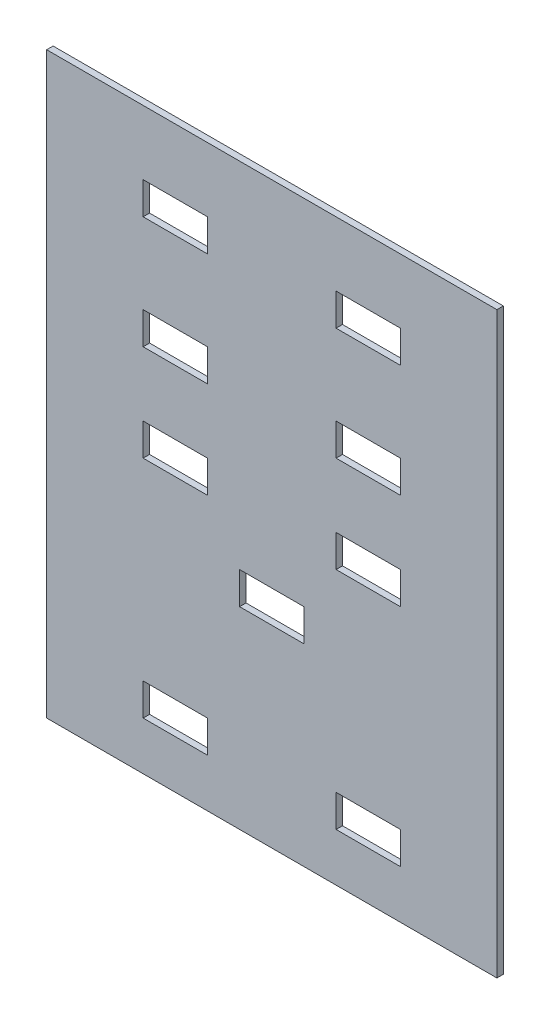
from build123d import *

# Parameters (mm, degrees)
SKETCH1_W           = 350
SKETCH1_H           = 450
BOSS_EXTRUDE1_DEPTH = 5
SKETCH2_W           = 50
SKETCH2_H           = 25
CUT_EXTRUDE1_DEPTH  = 571.109638578


with BuildPart() as part:
    # Sketch1 → Boss-Extrude1 (new body)
    with BuildSketch(Plane.XY):
        with Locations((175, 225)):
            Rectangle(SKETCH1_W, SKETCH1_H)
    extrude(amount=BOSS_EXTRUDE1_DEPTH)

    # Sketch2 → Cut-Extrude1 (cut, through all)
    with BuildSketch(Plane.XY.offset(5)):
        with Locations((100, 387.5)):
            Rectangle(SKETCH2_W, SKETCH2_H)
    cut_extrude1 = extrude(amount=-CUT_EXTRUDE1_DEPTH, mode=Mode.SUBTRACT)

    # Sketch-Pattern2: Cut-Extrude1 at 8 more places
    with Locations((0, -87.5, 0), (0, -162.5, 0), (0, -337.5, 0), (75, -225, 0), (150, 0, 0), (150, -87.5, 0), (150, -162.5, 0), (150, -337.5, 0)):
        add(cut_extrude1, mode=Mode.SUBTRACT)


solid = part.part
